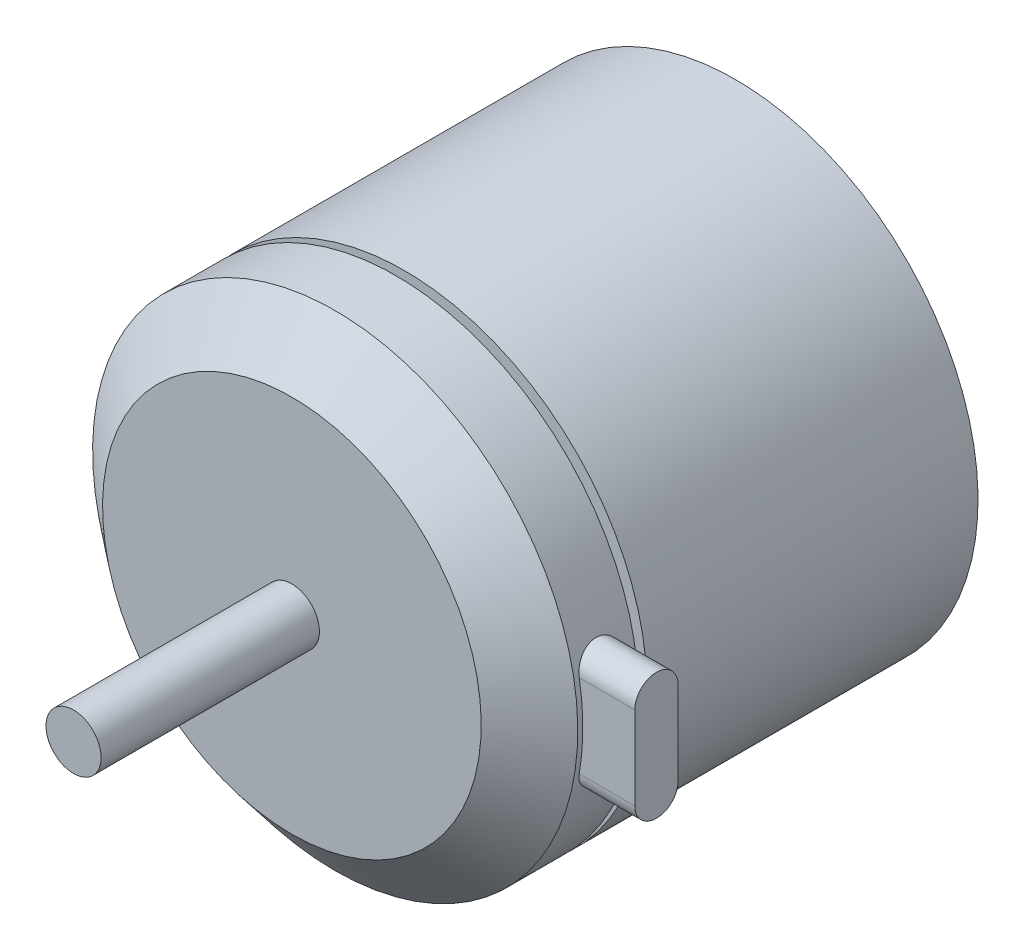
from build123d import *

# Parameters (mm, degrees)
BOSS_EXTRUDE1_DEPTH = 17


with BuildPart() as part:
    # Sketch1 → Revolve1 (revolve)
    with BuildSketch(Plane(origin=(0, 0, 0), x_dir=(0, 0, -1), z_dir=(1, 0, 0)), mode=Mode.PRIVATE) as revolve1_sk:
        Polygon((-22.55, 0), (-22.55, 1.59), (-9.95, 1.59), (-9.95, 10.926977996), (-7.45, 14), (-3.95, 14), (-3.95, 1.59), (-3.45, 1.59), (-3.45, 14), (15.65, 14), (21.05, 6.187841706), (21.05, 4), (21.652703363, 4), (22.55, 2.589018231), (22.55, 1.660098946), (22.479901054, 1.59), (22.55, 1.519901054), (22.55, 0), align=None)
    revolve(revolve1_sk.sketch.rotate(Axis((0, 0, 22.55), (0, 0, -1)), 180), axis=Axis((0, 0, 22.55), (0, 0, -1)))

    # Sketch2 → Boss-Extrude1 (add)
    with BuildSketch(Plane(origin=(0, 0, 0), x_dir=(0, 0, -1), z_dir=(1, 0, 0))):
        with BuildLine():
            Line((-4.658936123, 2.4), (-4.658936123, -2.4))
            ThreePointArc((-4.658936123, -2.4), (-5.908936123, -3.65), (-7.158936123, -2.4))
            Line((-7.158936123, -2.4), (-7.158936123, 2.4))
            ThreePointArc((-7.158936123, 2.4), (-5.908936123, 3.65), (-4.658936123, 2.4))
        make_face()
    extrude(amount=BOSS_EXTRUDE1_DEPTH)


solid = part.part
